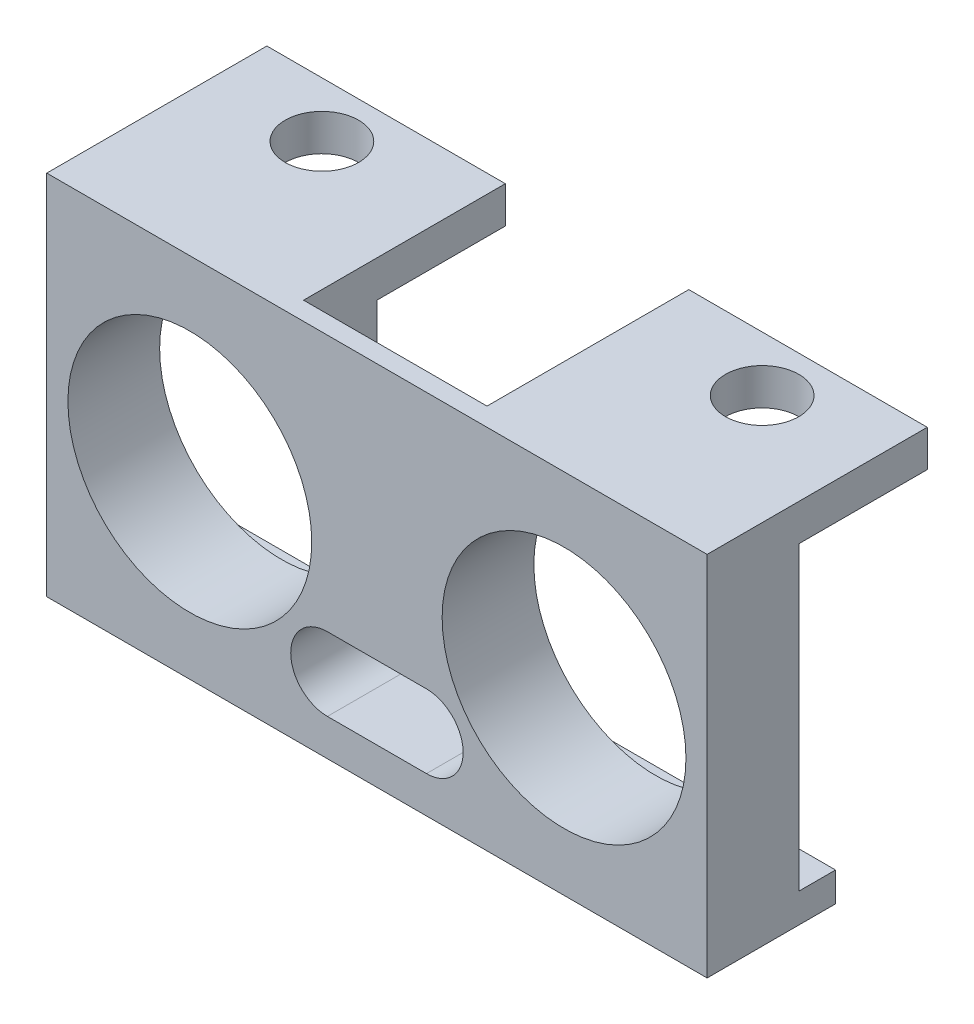
from build123d import *

# Parameters (mm, degrees)
SKETCH1_W           = 45.72
SKETCH1_H           = 22.86
SKETCH1_R           = 8.44
BOSS_EXTRUDE1_DEPTH = 6.35
SKETCH2_W           = 12.7
SKETCH2_H           = 3.81
CUT_EXTRUDE1_DEPTH  = 5.08
BOSS_EXTRUDE2_DEPTH = 2.54
SKETCH4_W           = 45.72
SKETCH4_H           = 2.032
BOSS_EXTRUDE3_DEPTH = 2.54
SKETCH5_R           = 2.54
CUT_EXTRUDE2_DEPTH  = 52.883813468


with BuildPart() as part:
    # Sketch1 → Boss-Extrude1 (new body)
    with BuildSketch(Plane.XY):
        with Locations((22.86, 11.43)):
            Rectangle(SKETCH1_W, SKETCH1_H)
        with Locations((9.906, 12.446)):
            Circle(SKETCH1_R, mode=Mode.SUBTRACT)
        with Locations((35.814, 12.446)):
            Circle(SKETCH1_R, mode=Mode.SUBTRACT)
        with BuildLine():
            Line((19.431, 7.62), (26.289, 7.62))
            ThreePointArc((26.289, 7.62), (28.829, 5.08), (26.289, 2.54))
            Line((26.289, 2.54), (19.431, 2.54))
            ThreePointArc((19.431, 2.54), (16.891, 5.08), (19.431, 7.62))
        make_face(mode=Mode.SUBTRACT)
    extrude(amount=BOSS_EXTRUDE1_DEPTH)

    # Sketch2 → Cut-Extrude1 (cut)
    with BuildSketch(Plane(origin=(0, 0, 0), x_dir=(-1, 0, 0), z_dir=(0, 0, -1))):
        with Locations((-22.86, 20.955)):
            Rectangle(SKETCH2_W, SKETCH2_H)
    extrude(amount=-CUT_EXTRUDE1_DEPTH, mode=Mode.SUBTRACT)

    # Sketch3 → Boss-Extrude2 (add)
    with BuildSketch(Plane(origin=(0, 22.86, 0), x_dir=(1, 0, 0), z_dir=(0, 1, 0))):
        Polygon((0, -6.35), (0, 8.89), (16.51, 8.89), (16.51, -5.08), (29.21, -5.08), (29.21, 8.89), (45.72, 8.89), (45.72, -6.35), align=None)
    extrude(amount=BOSS_EXTRUDE2_DEPTH)

    # Sketch4 → Boss-Extrude3 (add)
    with BuildSketch(Plane(origin=(0, 0, 0), x_dir=(-1, 0, 0), z_dir=(0, 0, -1))):
        with Locations((-22.86, 1.016)):
            Rectangle(SKETCH4_W, SKETCH4_H)
    extrude(amount=BOSS_EXTRUDE3_DEPTH)

    # Sketch5 → Cut-Extrude2 (cut, through all)
    with BuildSketch(Plane.XZ.offset(-22.86)):
        with Locations(Location((38.1, -5.08, 0), (0, 0, 270))):
            Circle(SKETCH5_R)
        with Locations(Location((7.62, -5.08, 0), (0, 0, 90))):
            Circle(SKETCH5_R)
    extrude(amount=-CUT_EXTRUDE2_DEPTH, mode=Mode.SUBTRACT)


solid = part.part
